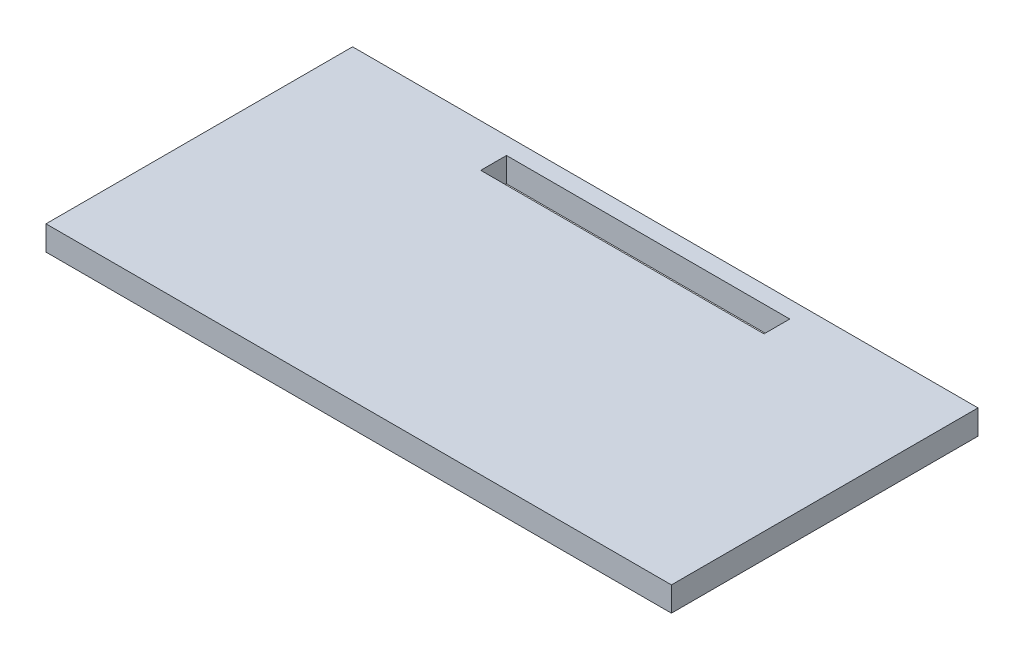
from build123d import *

# Parameters (mm, degrees)
SKETCH1_W               = 51
SKETCH1_H               = 25
BOSS_EXTRUDE1_DEPTH     = 2
CUT_EXTRUDE1_DEPTH      = 32.886989955
CUT_EXTRUDE1_DEPTH_BACK = 32.886989955
SKETCH3_W               = 13.1
SKETCH3_H               = 2.1
SKETCH4_W               = 23.1
SKETCH4_H               = 2.1
CUT_EXTRUDE2_DEPTH      = 10


with BuildPart() as part:
    # Sketch1 → Boss-Extrude1 (new body)
    with BuildSketch(Plane(origin=(0, 0, 0), x_dir=(1, 0, 0), z_dir=(0, 1, 0))):
        with Locations((-3.721556886, -0.104790419)):
            Rectangle(SKETCH1_W, SKETCH1_H)
    extrude(amount=BOSS_EXTRUDE1_DEPTH)

    # Sketch3 → Cut-Extrude1 (cut, two sides: drawn at the far end of the back side and taken through both)
    with BuildSketch(Plane(origin=(0, 2, 0), x_dir=(1, 0, 0), z_dir=(0, 1, 0)).offset(-CUT_EXTRUDE1_DEPTH_BACK)):
        with Locations((-3.721556886, 9.945209581)):
            Rectangle(SKETCH3_W, SKETCH3_H)
    extrude(amount=CUT_EXTRUDE1_DEPTH + CUT_EXTRUDE1_DEPTH_BACK, mode=Mode.SUBTRACT)

    # Sketch4 → Cut-Extrude2 (cut)
    with BuildSketch(Plane(origin=(0, 2, 0), x_dir=(1, 0, 0), z_dir=(0, 1, 0))):
        with Locations((-3.721556886, 9.945209581)):
            Rectangle(SKETCH4_W, SKETCH4_H)
    extrude(amount=-CUT_EXTRUDE2_DEPTH, mode=Mode.SUBTRACT)


solid = part.part
